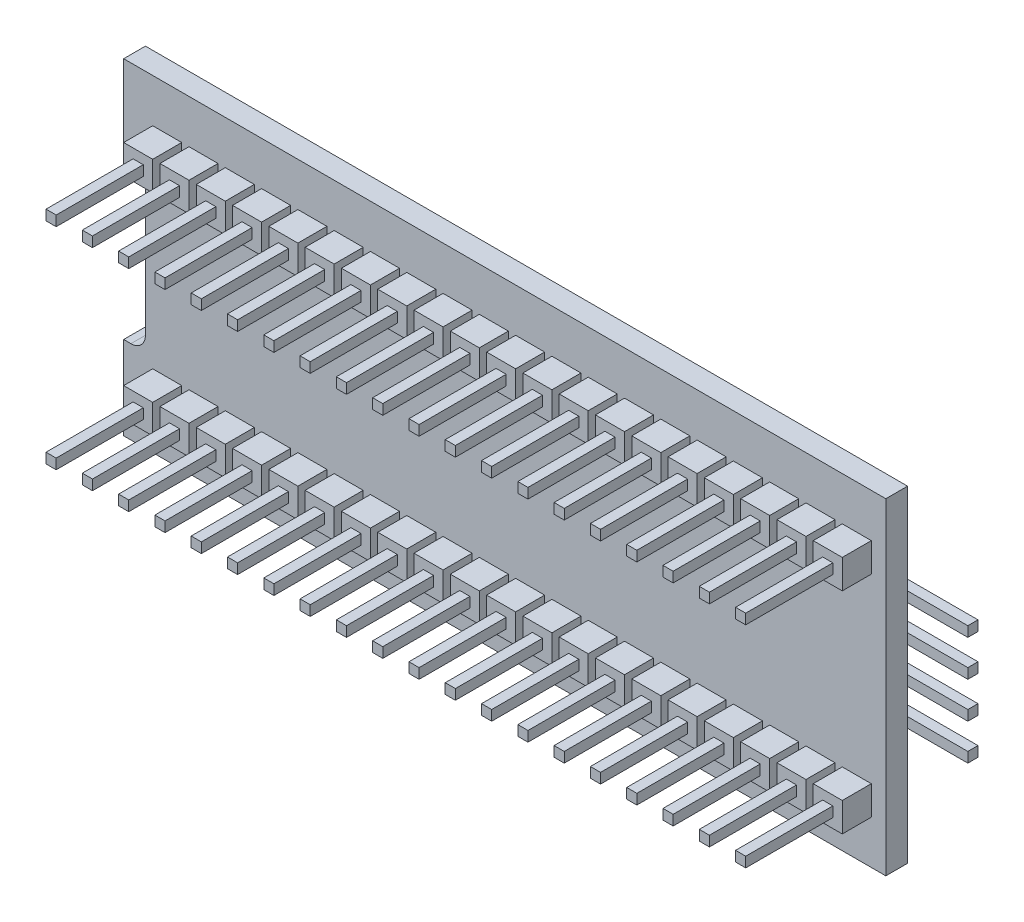
from build123d import *

# Parameters (mm, degrees)
SKETCH_1_W                 = 52.5
SKETCH_1_H                 = 22.5
EXTRUDE_1_DEPTH            = 1.5
CUT_EXTRUDE_1_REACH        = 30.599
SKETCH_2_W                 = 1.5
SKETCH_2_H                 = 11
FILLET_2_R                 = 1
FILLET_3_R                 = 1
SKETCH_3_W                 = 7.5
SKETCH_3_H                 = 5
EXTRUDE_2_DEPTH            = 8.5
SKETCH_4_W                 = 2
SKETCH_4_H                 = 2
EXTRUDE_3_DEPTH            = 2
SKETCH_5_W                 = 0.7
SKETCH_5_H                 = 0.7
EXTRUDE_4_DEPTH            = 8.5
PATTERN_LINEAR_1_COUNT     = 2
PATTERN_LINEAR_1_PITCH     = 2.5
PATTERN_LINEAR_1_COL_COUNT = 3
PATTERN_LINEAR_1_COL_PITCH = 2.5
SKETCH_7_W                 = 2
SKETCH_7_H                 = 2
EXTRUDE_5_DEPTH            = 2
SKETCH_8_W                 = 0.7
SKETCH_8_H                 = 0.7
EXTRUDE_6_DEPTH            = 6
PATTERN_LINEAR_2_COUNT     = 20
PATTERN_LINEAR_2_PITCH     = 2.5
MIRROR_1_COPY_1_SKETCH_W   = 2
MIRROR_1_COPY_1_SKETCH_H   = 2
MIRROR_1_COPY_1_DEPTH      = 2
MIRROR_1_COPY_2_SKETCH_W   = 2
MIRROR_1_COPY_2_SKETCH_H   = 2
MIRROR_1_COPY_2_DEPTH      = 2
MIRROR_1_COPY_3_SKETCH_W   = 2
MIRROR_1_COPY_3_SKETCH_H   = 2
MIRROR_1_COPY_3_DEPTH      = 2
MIRROR_1_COPY_4_SKETCH_W   = 2
MIRROR_1_COPY_4_SKETCH_H   = 2
MIRROR_1_COPY_4_DEPTH      = 2
MIRROR_1_COPY_5_SKETCH_W   = 2
MIRROR_1_COPY_5_SKETCH_H   = 2
MIRROR_1_COPY_5_DEPTH      = 2
MIRROR_1_COPY_6_SKETCH_W   = 2
MIRROR_1_COPY_6_SKETCH_H   = 2
MIRROR_1_COPY_6_DEPTH      = 2
MIRROR_1_COPY_7_SKETCH_W   = 2
MIRROR_1_COPY_7_SKETCH_H   = 2
MIRROR_1_COPY_7_DEPTH      = 2
MIRROR_1_COPY_8_SKETCH_W   = 2
MIRROR_1_COPY_8_SKETCH_H   = 2
MIRROR_1_COPY_8_DEPTH      = 2
MIRROR_1_COPY_9_SKETCH_W   = 2
MIRROR_1_COPY_9_SKETCH_H   = 2
MIRROR_1_COPY_9_DEPTH      = 2
MIRROR_1_COPY_10_SKETCH_W  = 2
MIRROR_1_COPY_10_SKETCH_H  = 2
MIRROR_1_COPY_10_DEPTH     = 2
MIRROR_1_COPY_11_SKETCH_W  = 2
MIRROR_1_COPY_11_SKETCH_H  = 2
MIRROR_1_COPY_11_DEPTH     = 2
MIRROR_1_COPY_12_SKETCH_W  = 2
MIRROR_1_COPY_12_SKETCH_H  = 2
MIRROR_1_COPY_12_DEPTH     = 2
MIRROR_1_COPY_13_SKETCH_W  = 2
MIRROR_1_COPY_13_SKETCH_H  = 2
MIRROR_1_COPY_13_DEPTH     = 2
MIRROR_1_COPY_14_SKETCH_W  = 2
MIRROR_1_COPY_14_SKETCH_H  = 2
MIRROR_1_COPY_14_DEPTH     = 2
MIRROR_1_COPY_15_SKETCH_W  = 2
MIRROR_1_COPY_15_SKETCH_H  = 2
MIRROR_1_COPY_15_DEPTH     = 2
MIRROR_1_COPY_16_SKETCH_W  = 2
MIRROR_1_COPY_16_SKETCH_H  = 2
MIRROR_1_COPY_16_DEPTH     = 2
MIRROR_1_COPY_17_SKETCH_W  = 2
MIRROR_1_COPY_17_SKETCH_H  = 2
MIRROR_1_COPY_17_DEPTH     = 2
MIRROR_1_COPY_18_SKETCH_W  = 2
MIRROR_1_COPY_18_SKETCH_H  = 2
MIRROR_1_COPY_18_DEPTH     = 2
MIRROR_1_COPY_19_SKETCH_W  = 2
MIRROR_1_COPY_19_SKETCH_H  = 2
MIRROR_1_COPY_19_DEPTH     = 2
MIRROR_1_COPY_20_SKETCH_W  = 0.7
MIRROR_1_COPY_20_SKETCH_H  = 0.7
MIRROR_1_COPY_20_DEPTH     = 6
MIRROR_1_COPY_21_SKETCH_W  = 0.7
MIRROR_1_COPY_21_SKETCH_H  = 0.7
MIRROR_1_COPY_21_DEPTH     = 6
MIRROR_1_COPY_22_SKETCH_W  = 0.7
MIRROR_1_COPY_22_SKETCH_H  = 0.7
MIRROR_1_COPY_22_DEPTH     = 6
MIRROR_1_COPY_23_SKETCH_W  = 0.7
MIRROR_1_COPY_23_SKETCH_H  = 0.7
MIRROR_1_COPY_23_DEPTH     = 6
MIRROR_1_COPY_24_SKETCH_W  = 0.7
MIRROR_1_COPY_24_SKETCH_H  = 0.7
MIRROR_1_COPY_24_DEPTH     = 6
MIRROR_1_COPY_25_SKETCH_W  = 0.7
MIRROR_1_COPY_25_SKETCH_H  = 0.7
MIRROR_1_COPY_25_DEPTH     = 6
MIRROR_1_COPY_26_SKETCH_W  = 0.7
MIRROR_1_COPY_26_SKETCH_H  = 0.7
MIRROR_1_COPY_26_DEPTH     = 6
MIRROR_1_COPY_27_SKETCH_W  = 0.7
MIRROR_1_COPY_27_SKETCH_H  = 0.7
MIRROR_1_COPY_27_DEPTH     = 6
MIRROR_1_COPY_28_SKETCH_W  = 0.7
MIRROR_1_COPY_28_SKETCH_H  = 0.7
MIRROR_1_COPY_28_DEPTH     = 6
MIRROR_1_COPY_29_SKETCH_W  = 0.7
MIRROR_1_COPY_29_SKETCH_H  = 0.7
MIRROR_1_COPY_29_DEPTH     = 6
MIRROR_1_COPY_30_SKETCH_W  = 0.7
MIRROR_1_COPY_30_SKETCH_H  = 0.7
MIRROR_1_COPY_30_DEPTH     = 6
MIRROR_1_COPY_31_SKETCH_W  = 0.7
MIRROR_1_COPY_31_SKETCH_H  = 0.7
MIRROR_1_COPY_31_DEPTH     = 6
MIRROR_1_COPY_32_SKETCH_W  = 0.7
MIRROR_1_COPY_32_SKETCH_H  = 0.7
MIRROR_1_COPY_32_DEPTH     = 6
MIRROR_1_COPY_33_SKETCH_W  = 0.7
MIRROR_1_COPY_33_SKETCH_H  = 0.7
MIRROR_1_COPY_33_DEPTH     = 6
MIRROR_1_COPY_34_SKETCH_W  = 0.7
MIRROR_1_COPY_34_SKETCH_H  = 0.7
MIRROR_1_COPY_34_DEPTH     = 6
MIRROR_1_COPY_35_SKETCH_W  = 0.7
MIRROR_1_COPY_35_SKETCH_H  = 0.7
MIRROR_1_COPY_35_DEPTH     = 6
MIRROR_1_COPY_36_SKETCH_W  = 0.7
MIRROR_1_COPY_36_SKETCH_H  = 0.7
MIRROR_1_COPY_36_DEPTH     = 6
MIRROR_1_COPY_37_SKETCH_W  = 0.7
MIRROR_1_COPY_37_SKETCH_H  = 0.7
MIRROR_1_COPY_37_DEPTH     = 6
MIRROR_1_COPY_38_SKETCH_W  = 0.7
MIRROR_1_COPY_38_SKETCH_H  = 0.7
MIRROR_1_COPY_38_DEPTH     = 6


with BuildPart() as part:
    # 草图1 → 凸台-拉伸1 (new body)
    with BuildSketch(Plane.XY):
        Rectangle(SKETCH_1_W, SKETCH_1_H)
    extrude(amount=EXTRUDE_1_DEPTH)

    # 草图2 → 切除-拉伸1 (cut, up to next)
    with BuildSketch(Plane(origin=(0, 0, 0), x_dir=(-1, 0, 0), z_dir=(0, 0, -1)), mode=Mode.PRIVATE) as cut_extrude_1_sk1:
        with Locations((25.5, 0)):
            Rectangle(SKETCH_2_W, SKETCH_2_H)
    cut_extrude_1_tool1 = extrude(cut_extrude_1_sk1.sketch, amount=-CUT_EXTRUDE_1_REACH, mode=Mode.PRIVATE) & part.part
    add(cut_extrude_1_tool1.solids().sort_by_distance((-25.5, 0, 0))[0], mode=Mode.SUBTRACT)

    # 圆角2
    fillet_2_edges = [part.edges().sort_by_distance(p)[0] for p in [
        (-24.75, -5.5, 0.75),
    ]]
    fillet(fillet_2_edges, radius=FILLET_2_R)

    # 圆角3
    fillet_3_edges = [part.edges().sort_by_distance(p)[0] for p in [
        (-24.75, 5.5, 0.75),
    ]]
    fillet(fillet_3_edges, radius=FILLET_3_R)

    # 草图3 → 凸台-拉伸2 (add)
    with BuildSketch(Plane(origin=(0, 0, 0), x_dir=(-1, 0, 0), z_dir=(0, 0, -1))):
        with Locations((14, -2.75)):
            Rectangle(SKETCH_3_W, SKETCH_3_H)
    extrude(amount=EXTRUDE_2_DEPTH)

    # 草图4 → 凸台-拉伸3 (add)
    with BuildSketch(Plane(origin=(0, 0, 0), x_dir=(-1, 0, 0), z_dir=(0, 0, -1))):
        with Locations((-22.25, 1.5)):
            Rectangle(SKETCH_4_W, SKETCH_4_H)
    extrude_3 = extrude(amount=EXTRUDE_3_DEPTH)

    # 草图5 → 凸台-拉伸4 (add)
    with BuildSketch(Plane.ZY.offset(-21.25)):
        with Locations((-1, 1.5)):
            Rectangle(SKETCH_5_W, SKETCH_5_H)
    extrude_4 = extrude(amount=-EXTRUDE_4_DEPTH)

    # 阵列(线性)1: 凸台-拉伸3, 凸台-拉伸4 ×2
    with Locations(*[(0, i * PATTERN_LINEAR_1_PITCH, 0) for i in range(1, PATTERN_LINEAR_1_COUNT)]):
        add(extrude_3)
        add(extrude_4)

    # 阵列(线性)1 col: 凸台-拉伸3, 凸台-拉伸4 ×3
    with Locations(*[(0, -i * PATTERN_LINEAR_1_COL_PITCH, 0) for i in range(1, PATTERN_LINEAR_1_COL_COUNT)]):
        add(extrude_3)
        add(extrude_4)

    # 草图7 → 凸台-拉伸5 (add)
    with BuildSketch(Plane.XY.offset(1.5)):
        with Locations((-23.25, -7.25)):
            Rectangle(SKETCH_7_W, SKETCH_7_H)
    extrude_5 = extrude(amount=EXTRUDE_5_DEPTH)

    # 草图8 → 凸台-拉伸6 (add)
    with BuildSketch(Plane.XY.offset(3.5)):
        with Locations((-23.25, -7.25)):
            Rectangle(SKETCH_8_W, SKETCH_8_H)
    extrude_6 = extrude(amount=EXTRUDE_6_DEPTH)

    # 阵列(线性)2: 凸台-拉伸5, 凸台-拉伸6 ×20
    with Locations(*[(i * PATTERN_LINEAR_2_PITCH, 0, 0) for i in range(1, PATTERN_LINEAR_2_COUNT)]):
        add(extrude_5)
        add(extrude_6)

    # 镜向1: 凸台-拉伸5, 凸台-拉伸6 across plane
    add(extrude_5.mirror(Plane.ZX))
    add(extrude_6.mirror(Plane.ZX))

    # 镜向1 copy 1 sketch → 镜向1 copy 1 (add)
    with BuildSketch(Plane(origin=(2.5, 0, 1.5), x_dir=(1, 0, 0), z_dir=(0, 0, 1))):
        with Locations((-23.25, 7.25)):
            Rectangle(MIRROR_1_COPY_1_SKETCH_W, MIRROR_1_COPY_1_SKETCH_H)
    extrude(amount=MIRROR_1_COPY_1_DEPTH)

    # 镜向1 copy 2 sketch → 镜向1 copy 2 (add)
    with BuildSketch(Plane(origin=(5, 0, 1.5), x_dir=(1, 0, 0), z_dir=(0, 0, 1))):
        with Locations((-23.25, 7.25)):
            Rectangle(MIRROR_1_COPY_2_SKETCH_W, MIRROR_1_COPY_2_SKETCH_H)
    extrude(amount=MIRROR_1_COPY_2_DEPTH)

    # 镜向1 copy 3 sketch → 镜向1 copy 3 (add)
    with BuildSketch(Plane(origin=(7.5, 0, 1.5), x_dir=(1, 0, 0), z_dir=(0, 0, 1))):
        with Locations((-23.25, 7.25)):
            Rectangle(MIRROR_1_COPY_3_SKETCH_W, MIRROR_1_COPY_3_SKETCH_H)
    extrude(amount=MIRROR_1_COPY_3_DEPTH)

    # 镜向1 copy 4 sketch → 镜向1 copy 4 (add)
    with BuildSketch(Plane(origin=(10, 0, 1.5), x_dir=(1, 0, 0), z_dir=(0, 0, 1))):
        with Locations((-23.25, 7.25)):
            Rectangle(MIRROR_1_COPY_4_SKETCH_W, MIRROR_1_COPY_4_SKETCH_H)
    extrude(amount=MIRROR_1_COPY_4_DEPTH)

    # 镜向1 copy 5 sketch → 镜向1 copy 5 (add)
    with BuildSketch(Plane(origin=(12.5, 0, 1.5), x_dir=(1, 0, 0), z_dir=(0, 0, 1))):
        with Locations((-23.25, 7.25)):
            Rectangle(MIRROR_1_COPY_5_SKETCH_W, MIRROR_1_COPY_5_SKETCH_H)
    extrude(amount=MIRROR_1_COPY_5_DEPTH)

    # 镜向1 copy 6 sketch → 镜向1 copy 6 (add)
    with BuildSketch(Plane(origin=(15, 0, 1.5), x_dir=(1, 0, 0), z_dir=(0, 0, 1))):
        with Locations((-23.25, 7.25)):
            Rectangle(MIRROR_1_COPY_6_SKETCH_W, MIRROR_1_COPY_6_SKETCH_H)
    extrude(amount=MIRROR_1_COPY_6_DEPTH)

    # 镜向1 copy 7 sketch → 镜向1 copy 7 (add)
    with BuildSketch(Plane(origin=(17.5, 0, 1.5), x_dir=(1, 0, 0), z_dir=(0, 0, 1))):
        with Locations((-23.25, 7.25)):
            Rectangle(MIRROR_1_COPY_7_SKETCH_W, MIRROR_1_COPY_7_SKETCH_H)
    extrude(amount=MIRROR_1_COPY_7_DEPTH)

    # 镜向1 copy 8 sketch → 镜向1 copy 8 (add)
    with BuildSketch(Plane(origin=(20, 0, 1.5), x_dir=(1, 0, 0), z_dir=(0, 0, 1))):
        with Locations((-23.25, 7.25)):
            Rectangle(MIRROR_1_COPY_8_SKETCH_W, MIRROR_1_COPY_8_SKETCH_H)
    extrude(amount=MIRROR_1_COPY_8_DEPTH)

    # 镜向1 copy 9 sketch → 镜向1 copy 9 (add)
    with BuildSketch(Plane(origin=(22.5, 0, 1.5), x_dir=(1, 0, 0), z_dir=(0, 0, 1))):
        with Locations((-23.25, 7.25)):
            Rectangle(MIRROR_1_COPY_9_SKETCH_W, MIRROR_1_COPY_9_SKETCH_H)
    extrude(amount=MIRROR_1_COPY_9_DEPTH)

    # 镜向1 copy 10 sketch → 镜向1 copy 10 (add)
    with BuildSketch(Plane(origin=(25, 0, 1.5), x_dir=(1, 0, 0), z_dir=(0, 0, 1))):
        with Locations((-23.25, 7.25)):
            Rectangle(MIRROR_1_COPY_10_SKETCH_W, MIRROR_1_COPY_10_SKETCH_H)
    extrude(amount=MIRROR_1_COPY_10_DEPTH)

    # 镜向1 copy 11 sketch → 镜向1 copy 11 (add)
    with BuildSketch(Plane(origin=(27.5, 0, 1.5), x_dir=(1, 0, 0), z_dir=(0, 0, 1))):
        with Locations((-23.25, 7.25)):
            Rectangle(MIRROR_1_COPY_11_SKETCH_W, MIRROR_1_COPY_11_SKETCH_H)
    extrude(amount=MIRROR_1_COPY_11_DEPTH)

    # 镜向1 copy 12 sketch → 镜向1 copy 12 (add)
    with BuildSketch(Plane(origin=(30, 0, 1.5), x_dir=(1, 0, 0), z_dir=(0, 0, 1))):
        with Locations((-23.25, 7.25)):
            Rectangle(MIRROR_1_COPY_12_SKETCH_W, MIRROR_1_COPY_12_SKETCH_H)
    extrude(amount=MIRROR_1_COPY_12_DEPTH)

    # 镜向1 copy 13 sketch → 镜向1 copy 13 (add)
    with BuildSketch(Plane(origin=(32.5, 0, 1.5), x_dir=(1, 0, 0), z_dir=(0, 0, 1))):
        with Locations((-23.25, 7.25)):
            Rectangle(MIRROR_1_COPY_13_SKETCH_W, MIRROR_1_COPY_13_SKETCH_H)
    extrude(amount=MIRROR_1_COPY_13_DEPTH)

    # 镜向1 copy 14 sketch → 镜向1 copy 14 (add)
    with BuildSketch(Plane(origin=(35, 0, 1.5), x_dir=(1, 0, 0), z_dir=(0, 0, 1))):
        with Locations((-23.25, 7.25)):
            Rectangle(MIRROR_1_COPY_14_SKETCH_W, MIRROR_1_COPY_14_SKETCH_H)
    extrude(amount=MIRROR_1_COPY_14_DEPTH)

    # 镜向1 copy 15 sketch → 镜向1 copy 15 (add)
    with BuildSketch(Plane(origin=(37.5, 0, 1.5), x_dir=(1, 0, 0), z_dir=(0, 0, 1))):
        with Locations((-23.25, 7.25)):
            Rectangle(MIRROR_1_COPY_15_SKETCH_W, MIRROR_1_COPY_15_SKETCH_H)
    extrude(amount=MIRROR_1_COPY_15_DEPTH)

    # 镜向1 copy 16 sketch → 镜向1 copy 16 (add)
    with BuildSketch(Plane(origin=(40, 0, 1.5), x_dir=(1, 0, 0), z_dir=(0, 0, 1))):
        with Locations((-23.25, 7.25)):
            Rectangle(MIRROR_1_COPY_16_SKETCH_W, MIRROR_1_COPY_16_SKETCH_H)
    extrude(amount=MIRROR_1_COPY_16_DEPTH)

    # 镜向1 copy 17 sketch → 镜向1 copy 17 (add)
    with BuildSketch(Plane(origin=(42.5, 0, 1.5), x_dir=(1, 0, 0), z_dir=(0, 0, 1))):
        with Locations((-23.25, 7.25)):
            Rectangle(MIRROR_1_COPY_17_SKETCH_W, MIRROR_1_COPY_17_SKETCH_H)
    extrude(amount=MIRROR_1_COPY_17_DEPTH)

    # 镜向1 copy 18 sketch → 镜向1 copy 18 (add)
    with BuildSketch(Plane(origin=(45, 0, 1.5), x_dir=(1, 0, 0), z_dir=(0, 0, 1))):
        with Locations((-23.25, 7.25)):
            Rectangle(MIRROR_1_COPY_18_SKETCH_W, MIRROR_1_COPY_18_SKETCH_H)
    extrude(amount=MIRROR_1_COPY_18_DEPTH)

    # 镜向1 copy 19 sketch → 镜向1 copy 19 (add)
    with BuildSketch(Plane(origin=(47.5, 0, 1.5), x_dir=(1, 0, 0), z_dir=(0, 0, 1))):
        with Locations((-23.25, 7.25)):
            Rectangle(MIRROR_1_COPY_19_SKETCH_W, MIRROR_1_COPY_19_SKETCH_H)
    extrude(amount=MIRROR_1_COPY_19_DEPTH)

    # 镜向1 copy 20 sketch → 镜向1 copy 20 (add)
    with BuildSketch(Plane(origin=(2.5, 0, 3.5), x_dir=(1, 0, 0), z_dir=(0, 0, 1))):
        with Locations((-23.25, 7.25)):
            Rectangle(MIRROR_1_COPY_20_SKETCH_W, MIRROR_1_COPY_20_SKETCH_H)
    extrude(amount=MIRROR_1_COPY_20_DEPTH)

    # 镜向1 copy 21 sketch → 镜向1 copy 21 (add)
    with BuildSketch(Plane(origin=(5, 0, 3.5), x_dir=(1, 0, 0), z_dir=(0, 0, 1))):
        with Locations((-23.25, 7.25)):
            Rectangle(MIRROR_1_COPY_21_SKETCH_W, MIRROR_1_COPY_21_SKETCH_H)
    extrude(amount=MIRROR_1_COPY_21_DEPTH)

    # 镜向1 copy 22 sketch → 镜向1 copy 22 (add)
    with BuildSketch(Plane(origin=(7.5, 0, 3.5), x_dir=(1, 0, 0), z_dir=(0, 0, 1))):
        with Locations((-23.25, 7.25)):
            Rectangle(MIRROR_1_COPY_22_SKETCH_W, MIRROR_1_COPY_22_SKETCH_H)
    extrude(amount=MIRROR_1_COPY_22_DEPTH)

    # 镜向1 copy 23 sketch → 镜向1 copy 23 (add)
    with BuildSketch(Plane(origin=(10, 0, 3.5), x_dir=(1, 0, 0), z_dir=(0, 0, 1))):
        with Locations((-23.25, 7.25)):
            Rectangle(MIRROR_1_COPY_23_SKETCH_W, MIRROR_1_COPY_23_SKETCH_H)
    extrude(amount=MIRROR_1_COPY_23_DEPTH)

    # 镜向1 copy 24 sketch → 镜向1 copy 24 (add)
    with BuildSketch(Plane(origin=(12.5, 0, 3.5), x_dir=(1, 0, 0), z_dir=(0, 0, 1))):
        with Locations((-23.25, 7.25)):
            Rectangle(MIRROR_1_COPY_24_SKETCH_W, MIRROR_1_COPY_24_SKETCH_H)
    extrude(amount=MIRROR_1_COPY_24_DEPTH)

    # 镜向1 copy 25 sketch → 镜向1 copy 25 (add)
    with BuildSketch(Plane(origin=(15, 0, 3.5), x_dir=(1, 0, 0), z_dir=(0, 0, 1))):
        with Locations((-23.25, 7.25)):
            Rectangle(MIRROR_1_COPY_25_SKETCH_W, MIRROR_1_COPY_25_SKETCH_H)
    extrude(amount=MIRROR_1_COPY_25_DEPTH)

    # 镜向1 copy 26 sketch → 镜向1 copy 26 (add)
    with BuildSketch(Plane(origin=(17.5, 0, 3.5), x_dir=(1, 0, 0), z_dir=(0, 0, 1))):
        with Locations((-23.25, 7.25)):
            Rectangle(MIRROR_1_COPY_26_SKETCH_W, MIRROR_1_COPY_26_SKETCH_H)
    extrude(amount=MIRROR_1_COPY_26_DEPTH)

    # 镜向1 copy 27 sketch → 镜向1 copy 27 (add)
    with BuildSketch(Plane(origin=(20, 0, 3.5), x_dir=(1, 0, 0), z_dir=(0, 0, 1))):
        with Locations((-23.25, 7.25)):
            Rectangle(MIRROR_1_COPY_27_SKETCH_W, MIRROR_1_COPY_27_SKETCH_H)
    extrude(amount=MIRROR_1_COPY_27_DEPTH)

    # 镜向1 copy 28 sketch → 镜向1 copy 28 (add)
    with BuildSketch(Plane(origin=(22.5, 0, 3.5), x_dir=(1, 0, 0), z_dir=(0, 0, 1))):
        with Locations((-23.25, 7.25)):
            Rectangle(MIRROR_1_COPY_28_SKETCH_W, MIRROR_1_COPY_28_SKETCH_H)
    extrude(amount=MIRROR_1_COPY_28_DEPTH)

    # 镜向1 copy 29 sketch → 镜向1 copy 29 (add)
    with BuildSketch(Plane(origin=(25, 0, 3.5), x_dir=(1, 0, 0), z_dir=(0, 0, 1))):
        with Locations((-23.25, 7.25)):
            Rectangle(MIRROR_1_COPY_29_SKETCH_W, MIRROR_1_COPY_29_SKETCH_H)
    extrude(amount=MIRROR_1_COPY_29_DEPTH)

    # 镜向1 copy 30 sketch → 镜向1 copy 30 (add)
    with BuildSketch(Plane(origin=(27.5, 0, 3.5), x_dir=(1, 0, 0), z_dir=(0, 0, 1))):
        with Locations((-23.25, 7.25)):
            Rectangle(MIRROR_1_COPY_30_SKETCH_W, MIRROR_1_COPY_30_SKETCH_H)
    extrude(amount=MIRROR_1_COPY_30_DEPTH)

    # 镜向1 copy 31 sketch → 镜向1 copy 31 (add)
    with BuildSketch(Plane(origin=(30, 0, 3.5), x_dir=(1, 0, 0), z_dir=(0, 0, 1))):
        with Locations((-23.25, 7.25)):
            Rectangle(MIRROR_1_COPY_31_SKETCH_W, MIRROR_1_COPY_31_SKETCH_H)
    extrude(amount=MIRROR_1_COPY_31_DEPTH)

    # 镜向1 copy 32 sketch → 镜向1 copy 32 (add)
    with BuildSketch(Plane(origin=(32.5, 0, 3.5), x_dir=(1, 0, 0), z_dir=(0, 0, 1))):
        with Locations((-23.25, 7.25)):
            Rectangle(MIRROR_1_COPY_32_SKETCH_W, MIRROR_1_COPY_32_SKETCH_H)
    extrude(amount=MIRROR_1_COPY_32_DEPTH)

    # 镜向1 copy 33 sketch → 镜向1 copy 33 (add)
    with BuildSketch(Plane(origin=(35, 0, 3.5), x_dir=(1, 0, 0), z_dir=(0, 0, 1))):
        with Locations((-23.25, 7.25)):
            Rectangle(MIRROR_1_COPY_33_SKETCH_W, MIRROR_1_COPY_33_SKETCH_H)
    extrude(amount=MIRROR_1_COPY_33_DEPTH)

    # 镜向1 copy 34 sketch → 镜向1 copy 34 (add)
    with BuildSketch(Plane(origin=(37.5, 0, 3.5), x_dir=(1, 0, 0), z_dir=(0, 0, 1))):
        with Locations((-23.25, 7.25)):
            Rectangle(MIRROR_1_COPY_34_SKETCH_W, MIRROR_1_COPY_34_SKETCH_H)
    extrude(amount=MIRROR_1_COPY_34_DEPTH)

    # 镜向1 copy 35 sketch → 镜向1 copy 35 (add)
    with BuildSketch(Plane(origin=(40, 0, 3.5), x_dir=(1, 0, 0), z_dir=(0, 0, 1))):
        with Locations((-23.25, 7.25)):
            Rectangle(MIRROR_1_COPY_35_SKETCH_W, MIRROR_1_COPY_35_SKETCH_H)
    extrude(amount=MIRROR_1_COPY_35_DEPTH)

    # 镜向1 copy 36 sketch → 镜向1 copy 36 (add)
    with BuildSketch(Plane(origin=(42.5, 0, 3.5), x_dir=(1, 0, 0), z_dir=(0, 0, 1))):
        with Locations((-23.25, 7.25)):
            Rectangle(MIRROR_1_COPY_36_SKETCH_W, MIRROR_1_COPY_36_SKETCH_H)
    extrude(amount=MIRROR_1_COPY_36_DEPTH)

    # 镜向1 copy 37 sketch → 镜向1 copy 37 (add)
    with BuildSketch(Plane(origin=(45, 0, 3.5), x_dir=(1, 0, 0), z_dir=(0, 0, 1))):
        with Locations((-23.25, 7.25)):
            Rectangle(MIRROR_1_COPY_37_SKETCH_W, MIRROR_1_COPY_37_SKETCH_H)
    extrude(amount=MIRROR_1_COPY_37_DEPTH)

    # 镜向1 copy 38 sketch → 镜向1 copy 38 (add)
    with BuildSketch(Plane(origin=(47.5, 0, 3.5), x_dir=(1, 0, 0), z_dir=(0, 0, 1))):
        with Locations((-23.25, 7.25)):
            Rectangle(MIRROR_1_COPY_38_SKETCH_W, MIRROR_1_COPY_38_SKETCH_H)
    extrude(amount=MIRROR_1_COPY_38_DEPTH)


solid = part.part
